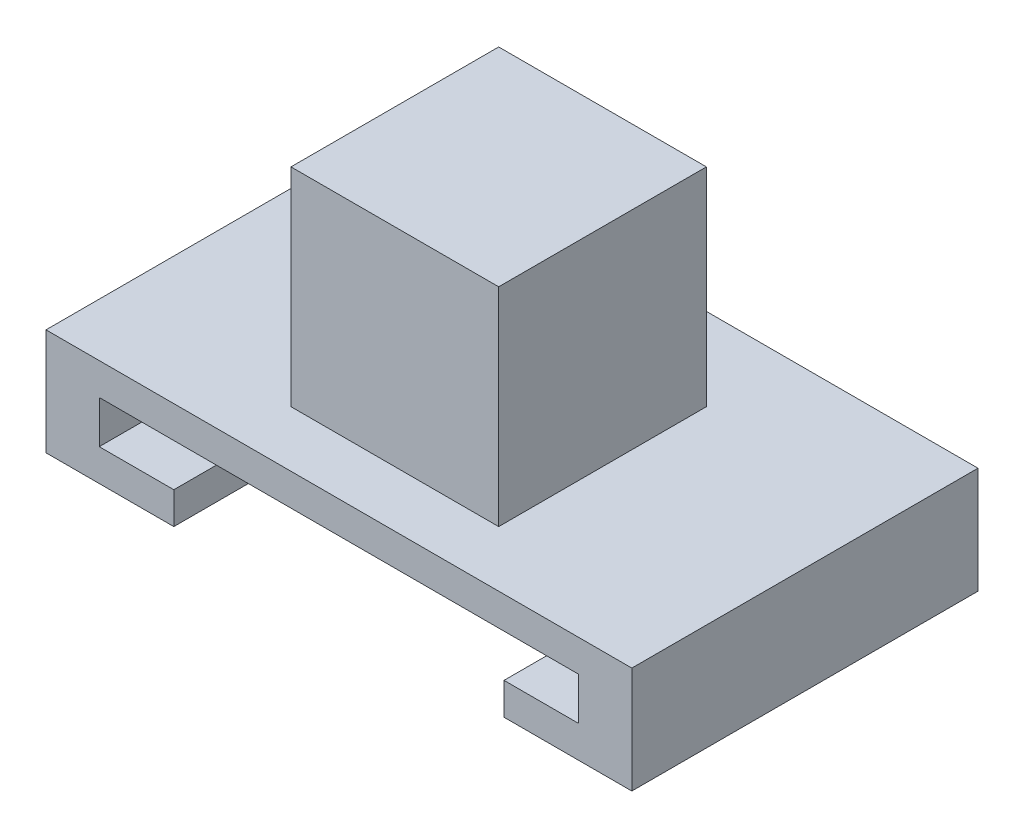
from build123d import *

# Parameters (mm, degrees)
BOSS_EXTRUDE1_DEPTH = 30
SKETCH2_W           = 19.5
SKETCH2_H           = 19.5
BOSS_EXTRUDE2_DEPTH = 19.5
SKETCH3_W           = 55
SKETCH3_H           = 10
BOSS_EXTRUDE3_DEPTH = 2.5


with BuildPart() as part:
    # Sketch1 → Boss-Extrude1 (new body)
    with BuildSketch(Plane.XY):
        Polygon((12, 0), (12, 3), (5, 3), (5, 7), (50, 7), (50, 3), (43, 3), (43, 0), (55, 0), (55, 10), (0, 10), (0, 0), align=None)
    extrude(amount=BOSS_EXTRUDE1_DEPTH)

    # Sketch2 → Boss-Extrude2 (add)
    with BuildSketch(Plane(origin=(0, 10, 0), x_dir=(1, 0, 0), z_dir=(0, 1, 0))):
        with Locations((27.5, -15)):
            Rectangle(SKETCH2_W, SKETCH2_H)
    extrude(amount=BOSS_EXTRUDE2_DEPTH)

    # Sketch3 → Boss-Extrude3 (add)
    with BuildSketch(Plane(origin=(0, 0, 0), x_dir=(-1, 0, 0), z_dir=(0, 0, -1))):
        with Locations((-27.5, 5)):
            Rectangle(SKETCH3_W, SKETCH3_H)
    extrude(amount=BOSS_EXTRUDE3_DEPTH)


solid = part.part
